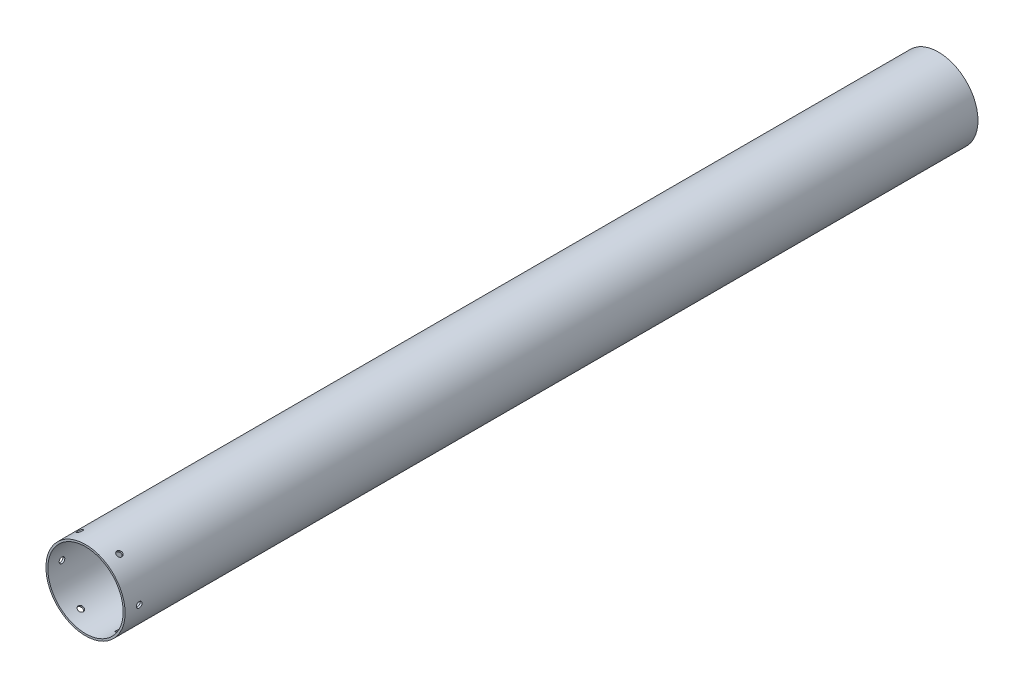
from build123d import *

# Parameters (mm, degrees)
SKETCH3_R               = 42
SKETCH3_R_2             = 40
BOSS_EXTRUDE1_DEPTH     = 905
CUT_EXTRUDE1_REACH      = 464.143
CUT_EXTRUDE1_END_RADIUS = 40
SKETCH4_R               = 3
CIRPATTERN1_COUNT       = 6


with BuildPart() as part:
    # Sketch3 → Boss-Extrude1 (new body)
    with BuildSketch(Plane.XY.offset(452.5)):
        Circle(SKETCH3_R)
        Circle(SKETCH3_R_2, mode=Mode.SUBTRACT)
    extrude(amount=-BOSS_EXTRUDE1_DEPTH)

    # Cut-Extrude1: up to this cylinder (the profile starts outside it)
    cut_extrude1_end = Plane(origin=(0, 0, 437.5), z_dir=(0, 0, 1)) * Cylinder(CUT_EXTRUDE1_END_RADIUS, 1009.286, mode=Mode.PRIVATE)
    # Sketch4 → Cut-Extrude1 (cut, up to the surface)
    with BuildSketch(Plane(origin=(42, 0, 0), x_dir=(0, 0, -1), z_dir=(1, 0, 0)), mode=Mode.PRIVATE) as cut_extrude1_sk1:
        with Locations((-437.5, 0)):
            Circle(SKETCH4_R)
    cut_extrude1_tool1 = extrude(cut_extrude1_sk1.sketch, amount=-CUT_EXTRUDE1_REACH, mode=Mode.PRIVATE) - cut_extrude1_end
    cut_extrude1 = cut_extrude1_tool1.solids().sort_by_distance((42, 0, 437.5))[0]
    add(cut_extrude1, mode=Mode.SUBTRACT)

    # CirPattern1: Cut-Extrude1 ×6 about axis
    cirpattern1_axis = Axis((0, 0, 452.5), (0, 0, 1))
    for i in range(1, CIRPATTERN1_COUNT):
        add(cut_extrude1.rotate(cirpattern1_axis, i * 360 / CIRPATTERN1_COUNT), mode=Mode.SUBTRACT)


solid = part.part
